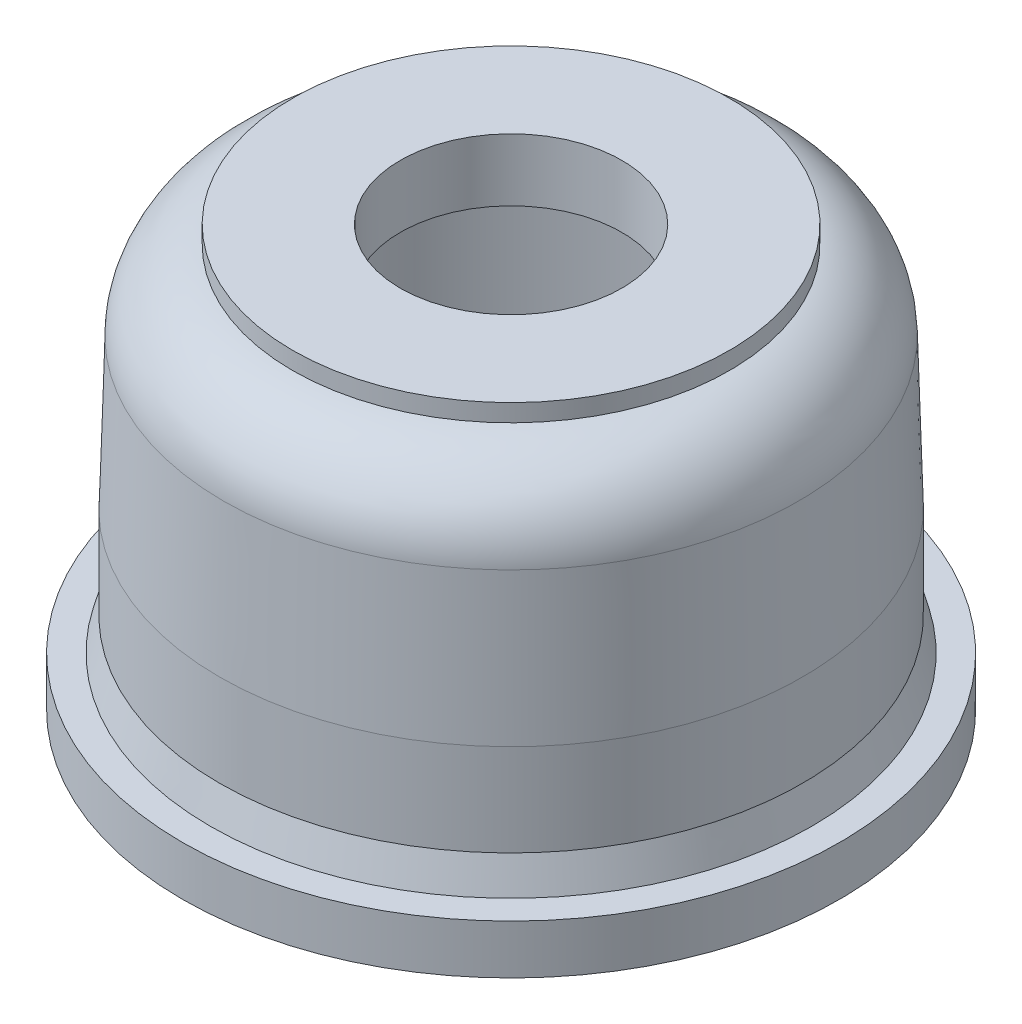
from build123d import *

# Parameters (mm, degrees)
IZIM2_R               = 6.74
KES_EKSTR_ZYON2_DEPTH = 10


with BuildPart() as part:
    # Çizim1 → Döndür5 (revolve)
    with BuildSketch(Plane.XY, mode=Mode.PRIVATE) as d_nd_r5_sk:
        with BuildLine():
            Line((0, 0), (0, -3.793704215))
            Line((0, -3.793704215), (10.989, -3.793704215))
            ThreePointArc((10.989, -3.793704215), (14.520998372, -5.256705843), (15.984, -8.788704215))
            Line((15.984, -8.788704215), (15.984, -20.253068743))
            ThreePointArc((15.984, -20.253068743), (16.169954521, -20.648816095), (16.23375, -21.081395785))
            Line((16.23375, -21.081395785), (16.23375, -23.695614881))
            Line((16.23375, -23.695614881), (18.796660871, -24.890719847))
            ThreePointArc((18.796660871, -24.890719847), (18.988452462, -24.878149162), (19.0809, -24.709639551))
            Line((19.0809, -24.709639551), (19.0809, -22.92705))
            Line((19.0809, -22.92705), (19.5804, -22.92705))
            Line((19.5804, -22.92705), (19.5804, -25.0749))
            ThreePointArc((19.5804, -25.0749), (19.252531022, -25.493267644), (18.727612723, -25.409659437))
            Line((18.727612723, -25.409659437), (16.23375, -24.246752151))
            Line((16.23375, -24.246752151), (16.23375, -24.577895785))
            ThreePointArc((16.23375, -24.577895785), (16.4835, -25.238672175), (17.107875, -25.56906037))
            Line((17.107875, -25.56906037), (17.144710109, -25.5744))
            Line((17.144710109, -25.5744), (19.98, -25.5744))
            Line((19.98, -25.5744), (19.98, -22.5774))
            Line((19.98, -22.5774), (18.2817, -22.5774))
            Line((18.2817, -22.5774), (17.73225, -20.5794))
            Line((17.73225, -20.5794), (17.73225, -14.982504215))
            Line((17.73225, -14.982504215), (17.474956676, -5.853279395))
            ThreePointArc((17.474956676, -5.853279395), (16.241892244, -2.705721011), (13.2867, -1.064255059))
            Line((13.2867, -1.064255059), (13.2867, 0))
            Line((13.2867, 0), (6.637906488, 0))
            Line((6.637906488, 0), (0, 0))
        make_face()
    revolve(d_nd_r5_sk.sketch.rotate(Axis((0, 0, 0), (0, -1, 0)), 90), axis=Axis((0, 0, 0), (0, -1, 0)))

    # Çizim2 → Kes-Ekstrüzyon2 (cut)
    with BuildSketch(Plane(origin=(0, 0, 0), x_dir=(1, 0, 0), z_dir=(0, 1, 0))):
        with Locations(Location((0, 0, 0), (0, 0, 270))):
            Circle(IZIM2_R)
    extrude(amount=-KES_EKSTR_ZYON2_DEPTH, mode=Mode.SUBTRACT)


solid = part.part
